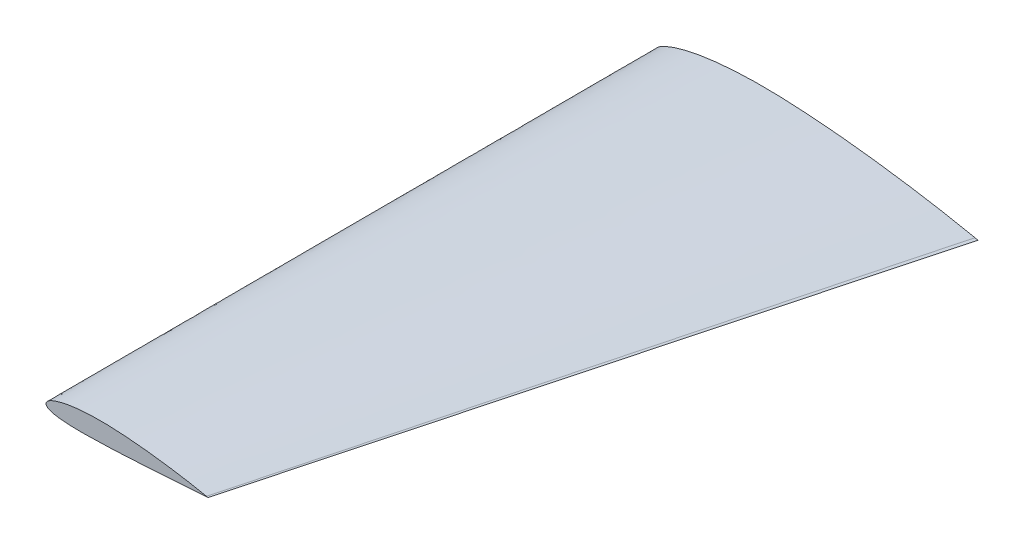
from build123d import *


with BuildPart() as part:
    # Sketch2 → Loft1 section 0
    with BuildSketch(Plane(origin=(0, 0, 635), x_dir=(-1, 0, 0), z_dir=(0, 0, -1))):
        with BuildLine():
            Line((-169.196790812, -0.106261686), (-167.614851485, -0.217899307))
            add(Edge.make_bspline(
                [(-167.614851485, -0.217899307), (-164.821379664, -0.415034901), (-159.234819668, -0.809279016), (-148.059466882, -1.559708278), (-134.094581706, -2.532626019), (-117.331203967, -3.589002101), (-100.570691986, -4.632629279), (-83.813022261, -5.636676957), (-67.050491916, -6.409168954), (-53.079989304, -6.853052562), (-41.904630449, -7.099731), (-33.521983393, -7.126356445), (-25.133349366, -6.935292197), (-18.147142261, -6.458738918), (-12.550308653, -5.839586915), (-8.337946809, -5.114065158), (-4.772995916, -4.102183675), (-1.742086063, -2.770070192), (1.055676712, 0.150647398), (-1.637759678, 3.473488773), (-4.726442675, 5.394919115), (-8.30714679, 6.979748518), (-12.533422707, 8.339941743), (-18.107945981, 9.836060456), (-25.100402137, 11.158474985), (-33.502285638, 12.232366659), (-41.893575231, 12.910514783), (-53.072820441, 13.373323238), (-67.060658026, 13.205311028), (-83.826006046, 12.212742421), (-100.595172978, 10.747040159), (-117.357072976, 8.745302518), (-134.121738448, 6.345031133), (-148.083053609, 4.0258737), (-159.246090253, 1.932772881), (-164.822820058, 0.790024712), (-167.614851485, 0.217899307)],
                knots=[0, 0, 0, 0, 0.024577283, 0.049151191, 0.098299006, 0.147433904, 0.196562636, 0.245679621, 0.294766051, 0.343825728, 0.36834792, 0.392865258, 0.417390833, 0.441968116, 0.454308961, 0.466764612, 0.479549009, 0.486390871, 0.496541147, 0.50873588, 0.516120591, 0.529593595, 0.542510181, 0.555201425, 0.580185204, 0.604908796, 0.629508374, 0.654047278, 0.703083425, 0.75219483, 0.801418903, 0.85079368, 0.900327075, 0.950040714, 0.97498751, 1, 1, 1, 1], degree=3))
            Line((-167.614851485, 0.217899307), (-169.196790812, -0.106261686))
        make_face()
    # Sketch1 → Loft1 section 1
    with BuildSketch(Plane.XY):
        with BuildLine():
            Line((335.22970297, -0.435798614), (338.393581623, -0.212523371))
            Line((338.393581623, -0.212523371), (335.22970297, 0.435798614))
            add(Edge.make_bspline(
                [(335.22970297, 0.435798614), (329.645640115, 1.580049425), (318.492180506, 3.865545762), (296.166107218, 8.051747399), (268.243476895, 12.690062266), (234.714145951, 17.490605035), (201.190345957, 21.494080318), (167.652012091, 24.425484843), (134.121316052, 26.410622057), (106.145640882, 26.746646475), (83.787150462, 25.821029567), (67.004571277, 24.464733318), (50.200804275, 22.316949969), (36.215891962, 19.672120912), (25.066845415, 16.679883486), (16.61429358, 13.959497036), (9.452885351, 10.78983823), (3.275519356, 6.946977547), (-2.111353424, 0.301294795), (3.484172125, -5.540140385), (9.545991831, -8.20436735), (16.675893617, -10.228130317), (25.100617306, -11.679173831), (36.294284523, -12.917477836), (50.266698732, -13.870584395), (67.043966786, -14.25271289), (83.809260898, -14.199462), (106.159978609, -13.706105123), (134.100983831, -12.818337908), (167.626044522, -11.273353914), (201.141383972, -9.265258558), (234.662407934, -7.178004203), (268.189163412, -5.065252038), (296.118933763, -3.119416556), (318.469639335, -1.618558032), (329.642759328, -0.830069803), (335.22970297, -0.435798614)],
                knots=[0, 0, 0, 0, 0.02501249, 0.049959286, 0.099672925, 0.14920632, 0.198581097, 0.24780517, 0.296916575, 0.345952722, 0.370491626, 0.395091204, 0.419814796, 0.444798575, 0.457489819, 0.470406405, 0.483879409, 0.49126412, 0.503458853, 0.513609129, 0.520450991, 0.533235388, 0.545691039, 0.558031884, 0.582609167, 0.607134742, 0.63165208, 0.656174272, 0.705233949, 0.754320379, 0.803437364, 0.852566096, 0.901700994, 0.950848809, 0.975422717, 1, 1, 1, 1], degree=3))
        make_face()
    loft()


solid = part.part
